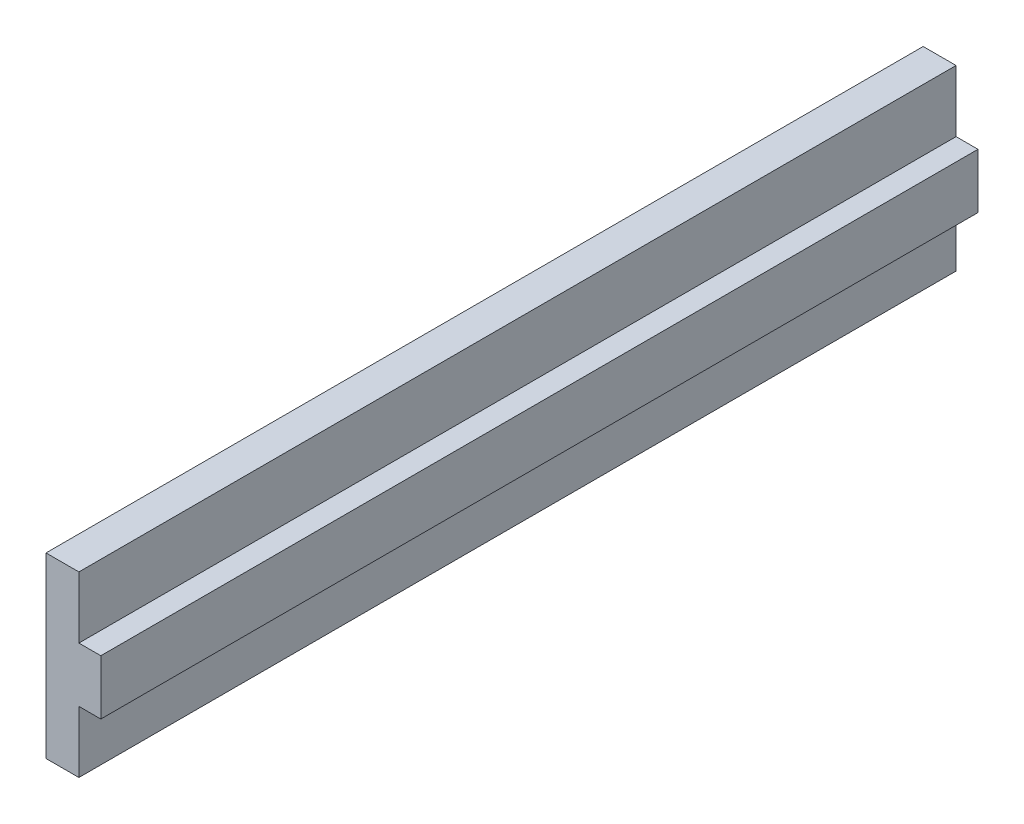
from build123d import *

# Parameters (mm, degrees)
BOSS_EXTRUDE1_DEPTH = 101.6


with BuildPart() as part:
    # Sketch1 → Boss-Extrude1 (new body)
    with BuildSketch(Plane.XY):
        Polygon((0, 0), (0, 20.6248), (3.81, 20.6248), (3.81, 13.4874), (6.35, 13.4874), (6.35, 7.1374), (3.81, 7.1374), (3.81, 0), align=None)
    extrude(amount=BOSS_EXTRUDE1_DEPTH)


solid = part.part
